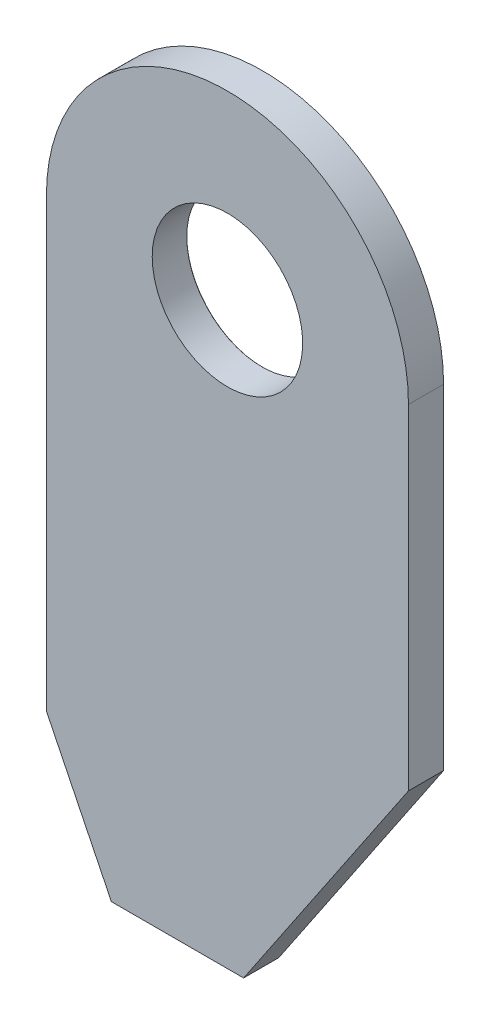
from build123d import *

# Parameters (mm, degrees)
BOSS_EXTRUDE1_DEPTH = 1.54


with BuildPart() as part:
    # Sketch1 → Boss-Extrude1 (new body)
    with BuildSketch(Plane.XY):
        with BuildLine():
            Line((7.939999995, -14.676928872), (7.939999995, 0))
            ThreePointArc((7.939999995, 0), (0, 7.939999995), (-7.939999995, 0))
            Line((-7.939999995, 0), (-7.939999995, -19.583493141))
            Line((-7.939999995, -19.583493141), (-5.090371955, -25.4))
            Line((-5.090371955, -25.4), (0.709510618, -25.4))
            Line((0.709510618, -25.4), (7.939999995, -14.676928872))
        make_face()
    extrude(amount=BOSS_EXTRUDE1_DEPTH)

    # Sketch3 → M6 Clearance Hole1 (revolve, cut)
    with BuildSketch(Plane.YZ):
        Polygon((0, 0), (0, 1.54), (3.3, 1.54), (3.3, 0.025), (3.325, 0), align=None)
    revolve(axis=Axis((0, 0, -6.35), (0, 0, 1)), mode=Mode.SUBTRACT)


solid = part.part
